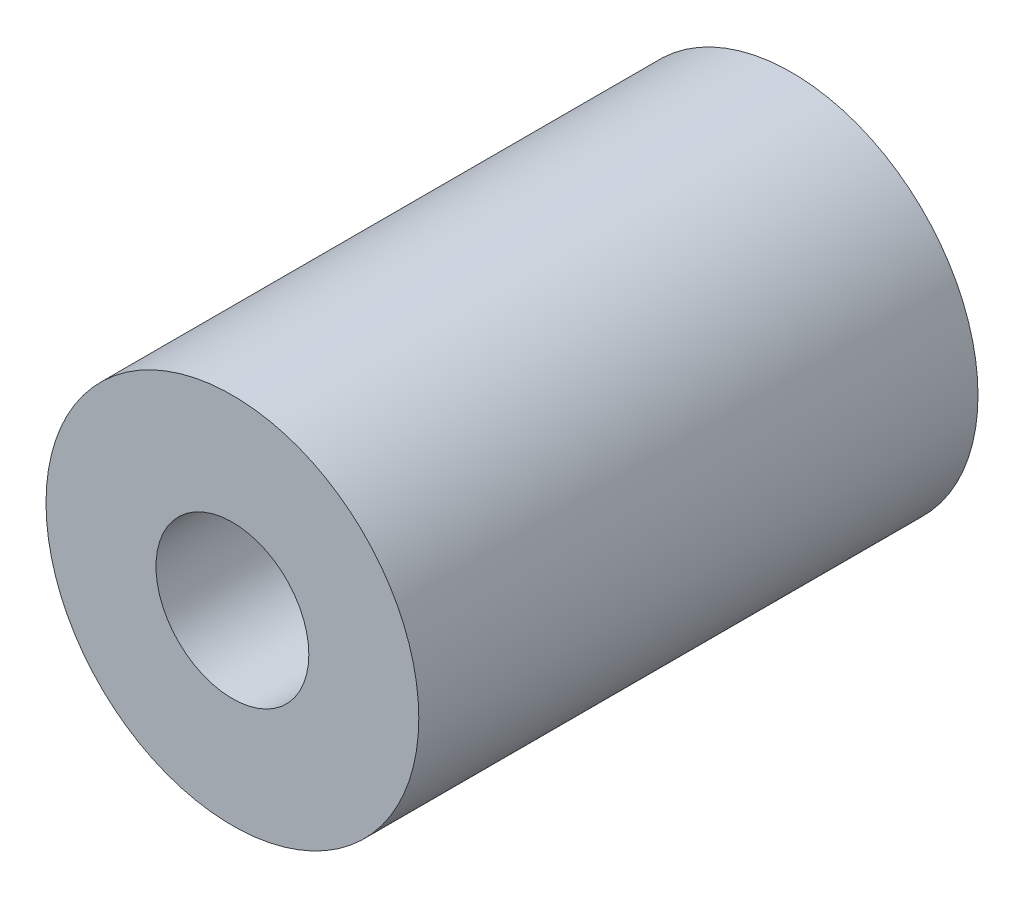
from build123d import *

# Parameters (mm, degrees)
SKETCH_2_R      = 10
SKETCH_2_R_2    = 4.1
EXTRUDE_1_DEPTH = 30


with BuildPart() as part:
    # ｽｹｯﾁ2 → ﾎﾞｽ - 押し出し1 (new body)
    with BuildSketch(Plane.XY):
        Circle(SKETCH_2_R)
        Circle(SKETCH_2_R_2, mode=Mode.SUBTRACT)
    extrude(amount=EXTRUDE_1_DEPTH)


solid = part.part
